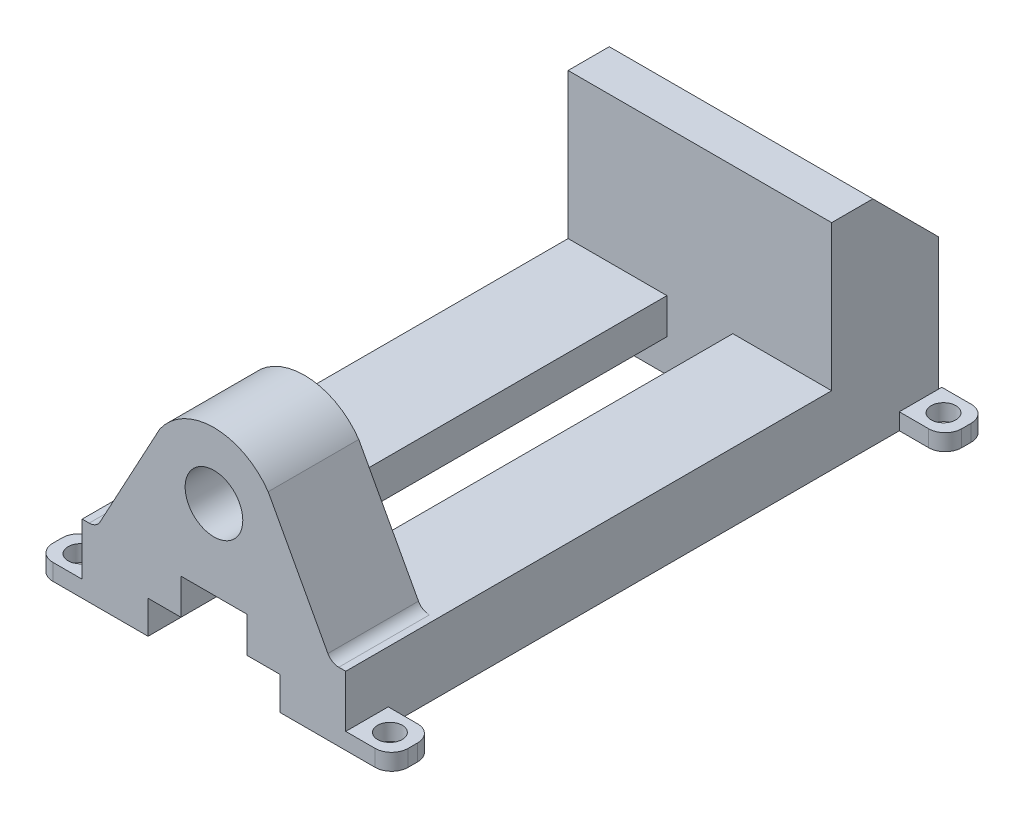
from build123d import *

# Parameters (mm, degrees)
BOSS_EXTRUDE1_DEPTH = 22
M16_TAPPED_HOLE1_D  = 14
BOSS_EXTRUDE2_DEPTH = 96
CUT_EXTRUDE1_DEPTH  = 127.957167334
SKETCH8_W           = 64
SKETCH8_H           = 52
BOSS_EXTRUDE3_DEPTH = 26
CHAMFER1_SIZE       = 16
SKETCH11_R          = 3
BOSS_EXTRUDE4_DEPTH = 4


with BuildPart() as part:
    # Sketch1 → Boss-Extrude1 (new body)
    with BuildSketch(Plane.XY):
        with BuildLine():
            Line((-31.551158378, -1.471617029), (-31.551158378, -18.121617029))
            Line((-31.551158378, -18.121617029), (32.448841622, -18.121617029))
            Line((32.448841622, -18.121617029), (32.448841622, -1.471617029))
            Line((32.448841622, -1.471617029), (30.752510469, -1.471617029))
            ThreePointArc((30.752510469, -1.471617029), (29.21725341, -1.04901606), (28.114530432, 0.099725795))
            Line((28.114530432, 0.099725795), (15.257528673, 23.839860621))
            Line((15.257528673, 23.839860621), (13.614601967, 26.873484031))
            ThreePointArc((13.614601967, 26.873484031), (0.448841622, 33.78157804), (-12.716918722, 26.873484031))
            Line((-12.716918722, 26.873484031), (-14.359845428, 23.839860621))
            Line((-14.359845428, 23.839860621), (-27.216847187, 0.099725795))
            ThreePointArc((-27.216847187, 0.099725795), (-28.319570165, -1.04901606), (-29.854827224, -1.471617029))
            Line((-29.854827224, -1.471617029), (-31.551158378, -1.471617029))
        make_face()
    extrude(amount=BOSS_EXTRUDE1_DEPTH)

    # M16 Tapped Hole1 (through all)
    with Locations(Plane.XY.offset(22)):
        with Locations((0.448841622, 17.78157804)):
            Hole(M16_TAPPED_HOLE1_D / 2)

    # Sketch4 → Boss-Extrude2 (add)
    with BuildSketch(Plane.XY):
        Polygon((16.448841622, -18.121617029), (16.448841622, -10.121617029), (8.448841622, -10.121617029), (8.448841622, -1.471617029), (32.448841622, -1.471617029), (32.448841622, -18.121617029), align=None)
        Polygon((-7.551158378, -10.121617029), (-7.551158378, -1.471617029), (-31.551158378, -1.471617029), (-31.551158378, -18.121617029), (-15.551158378, -18.121617029), (-15.551158378, -10.121617029), align=None)
    extrude(amount=-BOSS_EXTRUDE2_DEPTH)

    # Sketch5 → Cut-Extrude1 (cut, through all)
    with BuildSketch(Plane.XY.offset(22)):
        Polygon((-15.551158378, -18.121617029), (16.448841622, -18.121617029), (16.448841622, -10.121617029), (8.448841622, -10.121617029), (8.448841622, -1.471617029), (-7.551158378, -1.471617029), (-7.551158378, -10.121617029), (-15.551158378, -10.121617029), align=None)
    extrude(amount=-CUT_EXTRUDE1_DEPTH, mode=Mode.SUBTRACT)

    # Sketch8 → Boss-Extrude3 (add)
    with BuildSketch(Plane(origin=(0, 0, -96), x_dir=(-1, 0, 0), z_dir=(0, 0, -1))):
        with Locations((-0.448841622, 7.878382971)):
            Rectangle(SKETCH8_W, SKETCH8_H)
    extrude(amount=BOSS_EXTRUDE3_DEPTH)

    # Chamfer1
    chamfer1_edges = [part.edges().sort_by_distance(p)[0] for p in [
        (0.448841622, 33.878382971, -122),
    ]]
    chamfer(chamfer1_edges, length=CHAMFER1_SIZE)

    # Sketch11 → Boss-Extrude4 (add)
    # profile 1 of 4: a face of its own
    with BuildSketch(Plane(origin=(0, -18.121617029, 0), x_dir=(-1, 0, 0), z_dir=(0, -1, 0))):
        with BuildLine():
            Line((-32.448841622, -22), (-39.588841622, -22))
            ThreePointArc((-39.588841622, -22), (-42.417268747, -20.828427125), (-43.588841622, -18))
            Line((-43.588841622, -18), (-43.588841622, -15.68))
            ThreePointArc((-43.588841622, -15.68), (-42.417268747, -12.851572875), (-39.588841622, -11.68))
            Line((-39.588841622, -11.68), (-32.448841622, -11.68))
            Line((-32.448841622, -11.68), (-32.448841622, -22))
        make_face()
        with Locations(Location((-38.018841622, -16.84, 0), (0, 0, 90))):
            Circle(SKETCH11_R, mode=Mode.SUBTRACT)
    # profile 2 of 4: a face of its own
    with BuildSketch(Plane(origin=(0, -18.121617029, 0), x_dir=(-1, 0, 0), z_dir=(0, -1, 0))):
        with BuildLine():
            Line((31.551158378, -11.68), (38.691158378, -11.68))
            ThreePointArc((38.691158378, -11.68), (41.519585502, -12.851572875), (42.691158378, -15.68))
            Line((42.691158378, -15.68), (42.691158378, -18))
            ThreePointArc((42.691158378, -18), (41.519585502, -20.828427125), (38.691158378, -22))
            Line((38.691158378, -22), (31.551158378, -22))
            Line((31.551158378, -22), (31.551158378, -11.68))
        make_face()
        with Locations(Location((37.121158378, -16.84, 0), (0, 0, 270))):
            Circle(SKETCH11_R, mode=Mode.SUBTRACT)
    # profile 3 of 4: a face of its own
    with BuildSketch(Plane(origin=(0, -18.121617029, 0), x_dir=(-1, 0, 0), z_dir=(0, -1, 0))):
        with BuildLine():
            Line((-32.448841622, 112.43498208), (-39.588841622, 112.43498208))
            ThreePointArc((-39.588841622, 112.43498208), (-42.417268747, 113.606554955), (-43.588841622, 116.43498208))
            Line((-43.588841622, 116.43498208), (-43.588841622, 118.75498208))
            ThreePointArc((-43.588841622, 118.75498208), (-42.417268747, 121.583409205), (-39.588841622, 122.75498208))
            Line((-39.588841622, 122.75498208), (-32.448841622, 122.75498208))
            Line((-32.448841622, 122.75498208), (-32.448841622, 112.43498208))
        make_face()
        with Locations(Location((-38.018841622, 117.59498208, 0), (0, 0, 270))):
            Circle(SKETCH11_R, mode=Mode.SUBTRACT)
    # profile 4 of 4: a face of its own
    with BuildSketch(Plane(origin=(0, -18.121617029, 0), x_dir=(-1, 0, 0), z_dir=(0, -1, 0))):
        with BuildLine():
            Line((31.551158378, 122.75498208), (31.551158378, 112.43498208))
            Line((31.551158378, 112.43498208), (38.691158378, 112.43498208))
            ThreePointArc((38.691158378, 112.43498208), (41.519585502, 113.606554955), (42.691158378, 116.43498208))
            Line((42.691158378, 116.43498208), (42.691158378, 118.75498208))
            ThreePointArc((42.691158378, 118.75498208), (41.519585502, 121.583409205), (38.691158378, 122.75498208))
            Line((38.691158378, 122.75498208), (31.551158378, 122.75498208))
        make_face()
        with Locations(Location((37.121158378, 117.59498208, 0), (0, 0, 90))):
            Circle(SKETCH11_R, mode=Mode.SUBTRACT)
    extrude(amount=-BOSS_EXTRUDE4_DEPTH)


solid = part.part
